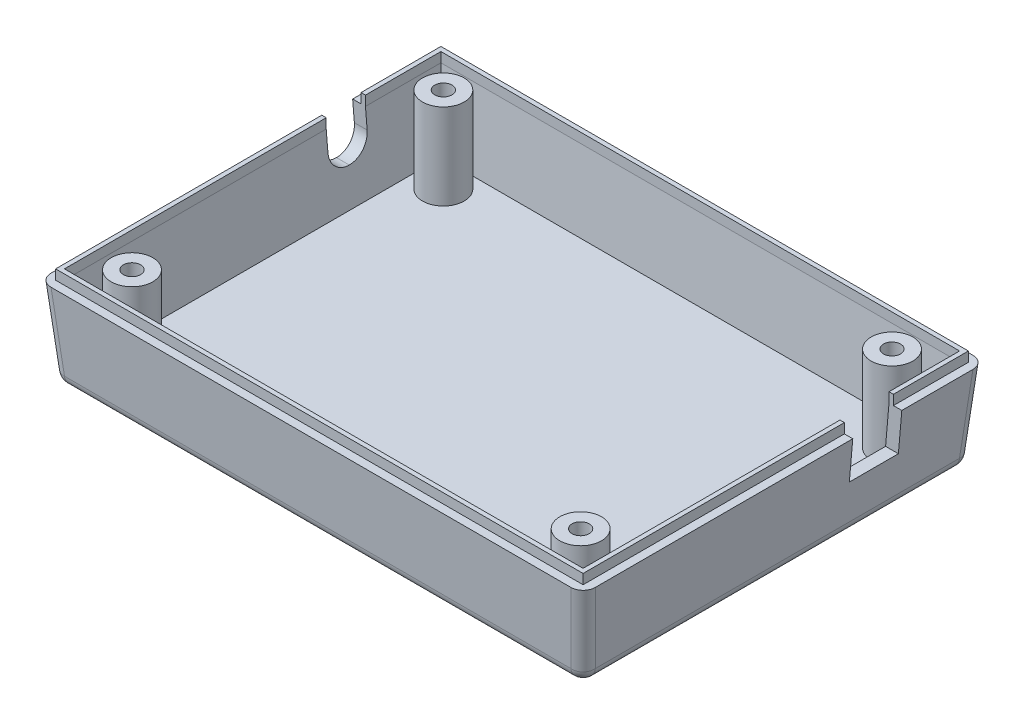
from build123d import *

# Parameters (mm, degrees)
SKETCH_1_W               = 111
SKETCH_1_H               = 82
EXTRUDE_1_DEPTH          = 18
EXTRUDE_1_DRAFT          = -5
SHELL_1_T                = -2.6
FILLET_1_R               = 2.5
SKETCH_2_W               = 107.580136844
SKETCH_2_H               = 78.580136844
SKETCH_2_W_2             = 105.780136844
SKETCH_2_H_2             = 76.780136844
EXTRUDE_2_DEPTH          = 2
SKETCH_4_R               = 4.25
EXTRUDE_3_DEPTH          = 17.5
MIRROR_2_COPY_1_SKETCH_R = 4.25
MIRROR_2_COPY_1_DEPTH    = 17.5
SKETCH_5_R               = 3.25
CUT_EXTRUDE_2_DEPTH      = 17.5
MIRROR_4_COPY_1_SKETCH_R = 3.25
MIRROR_4_COPY_1_DEPTH    = 17.5
SKETCH_6_R               = 1.75
CUT_EXTRUDE_3_DEPTH      = 3
MIRROR_6_COPY_1_SKETCH_R = 1.75
MIRROR_6_COPY_1_DEPTH    = 3
CUT_EXTRUDE_4_DEPTH      = 5
SKETCH_8_W               = 10
SKETCH_8_H               = 10
CUT_EXTRUDE_5_DEPTH      = 5


with BuildPart() as part:
    # Эскиз1 → Бобышка-Вытянуть1 (with draft: the straight prism first)
    with BuildSketch(Plane(origin=(0, 0, 0), x_dir=(1, 0, 0), z_dir=(0, 1, 0))):
        Rectangle(SKETCH_1_W, SKETCH_1_H)
    extrude(amount=-EXTRUDE_1_DEPTH)
    # Бобышка-Вытянуть1: the draft: its side faces are tilted about the plane it starts from
    extrude_1_sides = [part.faces().sort_by_distance(p)[0] for p in [
        (-55.5, -9, 0),
        (0, -9, 41),
        (55.5, -9, 0),
        (0, -9, -41),
    ]]
    draft(extrude_1_sides, Plane(origin=(0, 0, 0), x_dir=(1, 0, 0), z_dir=(0, 1, 0)), EXTRUDE_1_DRAFT)

    # Оболочка1
    shell_1_openings = [part.faces().sort_by_distance(p)[0] for p in [
        (0, 0, 0),
    ]]
    offset(amount=SHELL_1_T, openings=shell_1_openings, kind=Kind.INTERSECTION)

    # Скругление1
    fillet_1_edges = [part.edges().sort_by_distance(p)[0] for p in [
        (53.925204057, -18, 0),
        (0, -18, -39.425204057),
        (-53.925204057, -18, 0),
        (0, -18, 39.425204057),
        (-54.712602028, -9, -40.212602028),
        (54.712602028, -9, -40.212602028),
        (54.712602028, -9, 40.212602028),
        (-54.712602028, -9, 40.212602028),
    ]]
    fillet(fillet_1_edges, radius=FILLET_1_R)

    # Эскиз2 → Бобышка-Вытянуть2 (add)
    with BuildSketch(Plane(origin=(0, 0, 0), x_dir=(1, 0, 0), z_dir=(0, 1, 0))):
        Rectangle(SKETCH_2_W, SKETCH_2_H)
        Rectangle(SKETCH_2_W_2, SKETCH_2_H_2, mode=Mode.SUBTRACT)
    extrude(amount=EXTRUDE_2_DEPTH)

    # Эскиз4 → Бобышка-Вытянуть3 (add)
    with BuildSketch(Plane(origin=(0, -15.4, 0), x_dir=(1, 0, 0), z_dir=(0, 1, 0))):
        with Locations(Location((-45.75, 31.75, 0), (0, 0, 270))):
            Circle(SKETCH_4_R)
    extrude_3 = extrude(amount=EXTRUDE_3_DEPTH)

    # Зеркальное отражение1: Бобышка-Вытянуть3 across plane
    add(extrude_3.mirror(Plane(origin=(0, 0, 0), x_dir=(0, 0, 1), z_dir=(1, 0, 0))))

    # Зеркальное отражение2: Бобышка-Вытянуть3 across plane
    add(extrude_3.mirror(Plane.XY))

    # Зеркальное отражение2 copy 1 sketch → Зеркальное отражение2 copy 1 (add)
    with BuildSketch(Plane(origin=(0, -15.4, 0), x_dir=(-1, 0, 0), z_dir=(0, 1, 0))):
        with Locations(Location((-45.75, 31.75, 0), (0, 0, 270))):
            Circle(MIRROR_2_COPY_1_SKETCH_R)
    extrude(amount=MIRROR_2_COPY_1_DEPTH)

    # Эскиз5 → Вырез-Вытянуть2 (cut)
    with BuildSketch(Plane(origin=(0, -18, 0), x_dir=(1, 0, 0), z_dir=(0, 1, 0))):
        with Locations(Location((-45.75, 31.75, 0), (0, 0, 270))):
            Circle(SKETCH_5_R)
    cut_extrude_2 = extrude(amount=CUT_EXTRUDE_2_DEPTH, mode=Mode.SUBTRACT)

    # Зеркальное отражение3: Вырез-Вытянуть2 across plane
    add(cut_extrude_2.mirror(Plane(origin=(0, 0, 0), x_dir=(0, 0, 1), z_dir=(1, 0, 0))), mode=Mode.SUBTRACT)

    # Зеркальное отражение4: Вырез-Вытянуть2 across plane
    add(cut_extrude_2.mirror(Plane.XY), mode=Mode.SUBTRACT)

    # Зеркальное отражение4 copy 1 sketch → Зеркальное отражение4 copy 1 (cut)
    with BuildSketch(Plane(origin=(0, -18, 0), x_dir=(-1, 0, 0), z_dir=(0, 1, 0))):
        with Locations(Location((-45.75, 31.75, 0), (0, 0, 270))):
            Circle(MIRROR_4_COPY_1_SKETCH_R)
    extrude(amount=MIRROR_4_COPY_1_DEPTH, mode=Mode.SUBTRACT)

    # Эскиз6 → Вырез-Вытянуть3 (cut)
    with BuildSketch(Plane(origin=(0, 2.1, 0), x_dir=(-1, 0, 0), z_dir=(0, 1, 0))):
        with Locations(Location((45.75, -31.75, 0), (0, 0, 90))):
            Circle(SKETCH_6_R)
    cut_extrude_3 = extrude(amount=-CUT_EXTRUDE_3_DEPTH, mode=Mode.SUBTRACT)

    # Зеркальное отражение5: Вырез-Вытянуть3 across plane
    add(cut_extrude_3.mirror(Plane(origin=(0, 0, 0), x_dir=(0, 0, 1), z_dir=(1, 0, 0))), mode=Mode.SUBTRACT)

    # Зеркальное отражение6: Вырез-Вытянуть3 across plane
    add(cut_extrude_3.mirror(Plane.XY), mode=Mode.SUBTRACT)

    # Зеркальное отражение6 copy 1 sketch → Зеркальное отражение6 copy 1 (cut)
    with BuildSketch(Plane(origin=(0, 2.1, 0), x_dir=(1, 0, 0), z_dir=(0, 1, 0))):
        with Locations(Location((45.75, -31.75, 0), (0, 0, 90))):
            Circle(MIRROR_6_COPY_1_SKETCH_R)
    extrude(amount=-MIRROR_6_COPY_1_DEPTH, mode=Mode.SUBTRACT)

    # Эскиз7 → Вырез-Вытянуть4 (cut)
    with BuildSketch(Plane(origin=(-55.5, 0, 0), x_dir=(0, 0, -1), z_dir=(1, 0, 0))):
        with BuildLine():
            Line((19.001, -8), (18.999, -8))
            ThreePointArc((18.999, -8), (16.171279982, -6.828720018), (15, -4.001))
            Line((15, -4.001), (15, 2))
            Line((15, 2), (23, 2))
            Line((23, 2), (23, -4.001))
            ThreePointArc((23, -4.001), (21.828720018, -6.828720018), (19.001, -8))
        make_face()
    extrude(amount=CUT_EXTRUDE_4_DEPTH, mode=Mode.SUBTRACT)

    # Эскиз8 → Вырез-Вытянуть5 (cut)
    with BuildSketch(Plane(origin=(55.5, 0, 0), x_dir=(0, 0, -1), z_dir=(1, 0, 0))):
        with Locations((19, -3)):
            Rectangle(SKETCH_8_W, SKETCH_8_H)
    extrude(amount=-CUT_EXTRUDE_5_DEPTH, mode=Mode.SUBTRACT)


solid = part.part
